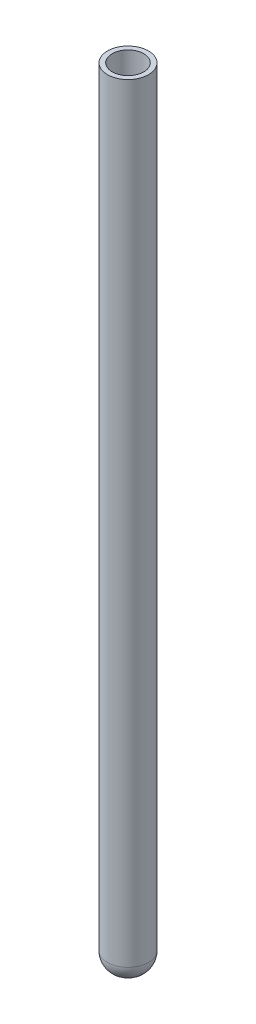
from build123d import *

# Parameters (mm, degrees)
FILLET1_R = 0.3


with BuildPart() as part:
    # Sketch1 → Revolve1 (revolve)
    with BuildSketch(Plane(origin=(0, 0, 0), x_dir=(0, 0, -1), z_dir=(1, 0, 0)), mode=Mode.PRIVATE) as revolve1_sk:
        Polygon((0.265, 0), (0.265, -10), (0, -10), (0, -13.21), (0.345, -13.21), (0.345, 0), align=None)
    revolve(revolve1_sk.sketch.rotate(Axis((0, -10, 0), (0, -1, 0)), 180), axis=Axis((0, -10, 0), (0, -1, 0)))

    # Fillet1
    fillet1_edges = [part.edges().sort_by_distance(p)[0] for p in [
        (0, -13.21, -0.345),
    ]]
    fillet(fillet1_edges, radius=FILLET1_R)


solid = part.part
